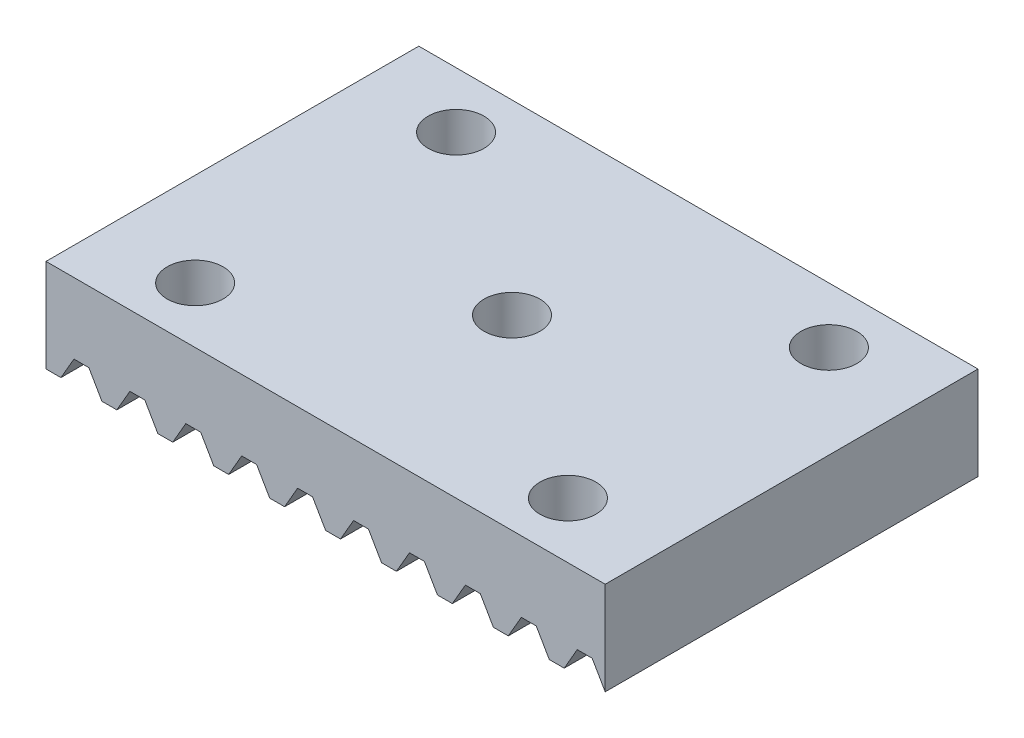
from build123d import *

# Parameters (mm, degrees)
SKETCH_1_W             = 30
SKETCH_1_H             = 20
SKETCH_1_R             = 1.5
EXTRUDE_1_DEPTH        = 5
CUT_EXTRUDE_1_DEPTH    = 19.708286934
PATTERN_LINEAR_1_COUNT = 10
PATTERN_LINEAR_1_PITCH = 3


with BuildPart() as part:
    # 草图1 → 凸台-拉伸1 (new body)
    with BuildSketch(Plane(origin=(0, 0, 0), x_dir=(1, 0, 0), z_dir=(0, 1, 0))):
        Rectangle(SKETCH_1_W, SKETCH_1_H)
        with Locations(Location((-10, 7, 0), (0, 0, 270))):
            Circle(SKETCH_1_R, mode=Mode.SUBTRACT)
        with Locations(Location((10, 7, 0), (0, 0, 90))):
            Circle(SKETCH_1_R, mode=Mode.SUBTRACT)
        with Locations(Location((10, -7, 0), (0, 0, 270))):
            Circle(SKETCH_1_R, mode=Mode.SUBTRACT)
        with Locations(Location((-10, -7, 0), (0, 0, 90))):
            Circle(SKETCH_1_R, mode=Mode.SUBTRACT)
        with Locations(Location((0, 0, 0), (0, 0, 270))):
            Circle(SKETCH_1_R, mode=Mode.SUBTRACT)
    extrude(amount=EXTRUDE_1_DEPTH)

    # 草图2 → 切除-拉伸1 (cut, symmetric)
    with BuildSketch(Plane.XY):
        Polygon((-85.827625303, 0), (-15, 0), (-14.2, 0), (-13.5, 1.212435565), (-12.7, 1.212435565), (-12, 0), (23.413812651, -61.338522802), (-45.939949713, -184.854779506), (-155.181387668, -123.516256704), align=None)
    cut_extrude_1 = extrude(amount=CUT_EXTRUDE_1_DEPTH, both=True, mode=Mode.SUBTRACT)

    # 阵列(线性)1: 切除-拉伸1 ×10
    with Locations(*[(i * PATTERN_LINEAR_1_PITCH, 0, 0) for i in range(1, PATTERN_LINEAR_1_COUNT)]):
        add(cut_extrude_1, mode=Mode.SUBTRACT)


solid = part.part
